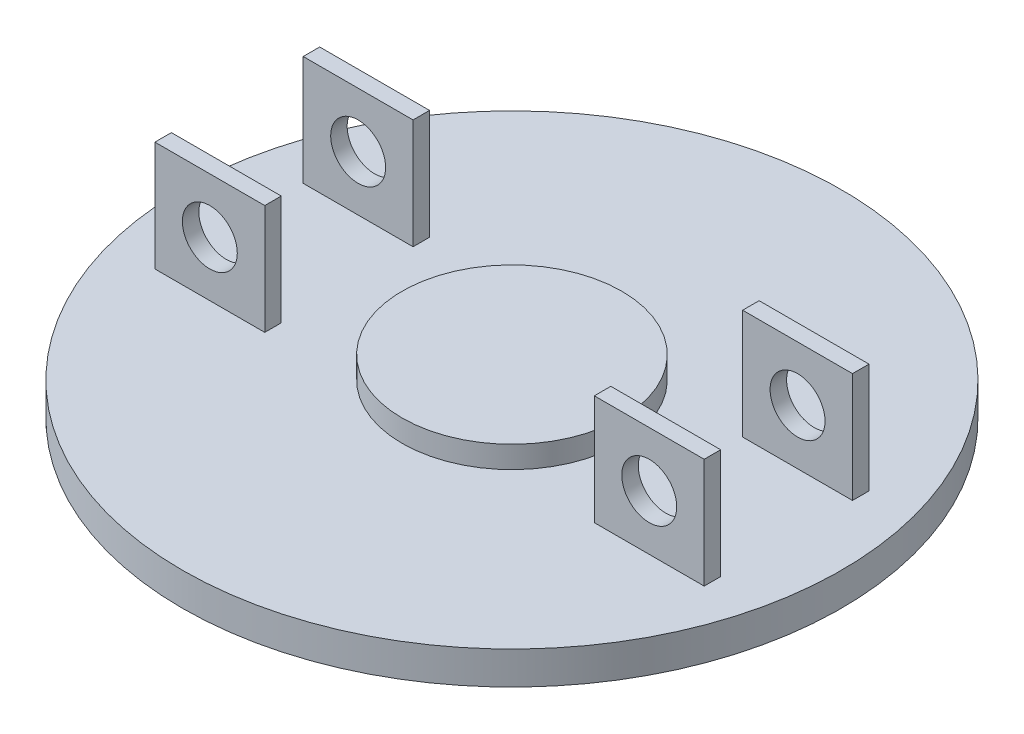
from build123d import *

# Parameters (mm, degrees)
SKETCH1_R           = 30
BOSS_EXTRUDE1_DEPTH = 3
SKETCH2_R           = 10
BOSS_EXTRUDE2_DEPTH = 2
SKETCH3_W           = 10
SKETCH3_H           = 15
BOSS_EXTRUDE3_DEPTH = 10
CUT_EXTRUDE1_START  = -1.5
SKETCH4_W           = 10
SKETCH4_H           = 10
CUT_EXTRUDE1_DEPTH  = 12
SKETCH5_R           = 2.5
CUT_EXTRUDE2_DEPTH  = 50.751884386


with BuildPart() as part:
    # Sketch1 → Boss-Extrude1 (new body)
    with BuildSketch(Plane(origin=(0, 0, 0), x_dir=(1, 0, 0), z_dir=(0, 1, 0))):
        with Locations(Location((0, 0, 0), (0, 0, 270))):
            Circle(SKETCH1_R)
    extrude(amount=BOSS_EXTRUDE1_DEPTH)

    # Sketch2 → Boss-Extrude2 (add)
    with BuildSketch(Plane(origin=(0, 3, 0), x_dir=(1, 0, 0), z_dir=(0, 1, 0))):
        with Locations(Location((0, 0, 0), (0, 0, 270))):
            Circle(SKETCH2_R)
    extrude(amount=BOSS_EXTRUDE2_DEPTH)

    # Sketch3 → Boss-Extrude3 (add)
    with BuildSketch(Plane(origin=(0, 3, 0), x_dir=(1, 0, 0), z_dir=(0, 1, 0))):
        with Locations((-20, 0)):
            Rectangle(SKETCH3_W, SKETCH3_H)
        with Locations((20, 0)):
            Rectangle(SKETCH3_W, SKETCH3_H)
    extrude(amount=BOSS_EXTRUDE3_DEPTH)

    # Sketch4 → Cut-Extrude1 (cut)
    with BuildSketch(Plane.XY.offset(7.5).offset(CUT_EXTRUDE1_START)):
        with Locations((-20, 8)):
            Rectangle(SKETCH4_W, SKETCH4_H)
        with Locations((20, 8)):
            Rectangle(SKETCH4_W, SKETCH4_H)
    extrude(amount=-CUT_EXTRUDE1_DEPTH, mode=Mode.SUBTRACT)

    # Sketch5 → Cut-Extrude2 (cut, through all)
    with BuildSketch(Plane.XY.offset(7.5)):
        with Locations((20, 8)):
            Circle(SKETCH5_R)
        with Locations((-20, 8)):
            Circle(SKETCH5_R)
    extrude(amount=-CUT_EXTRUDE2_DEPTH, mode=Mode.SUBTRACT)


solid = part.part
